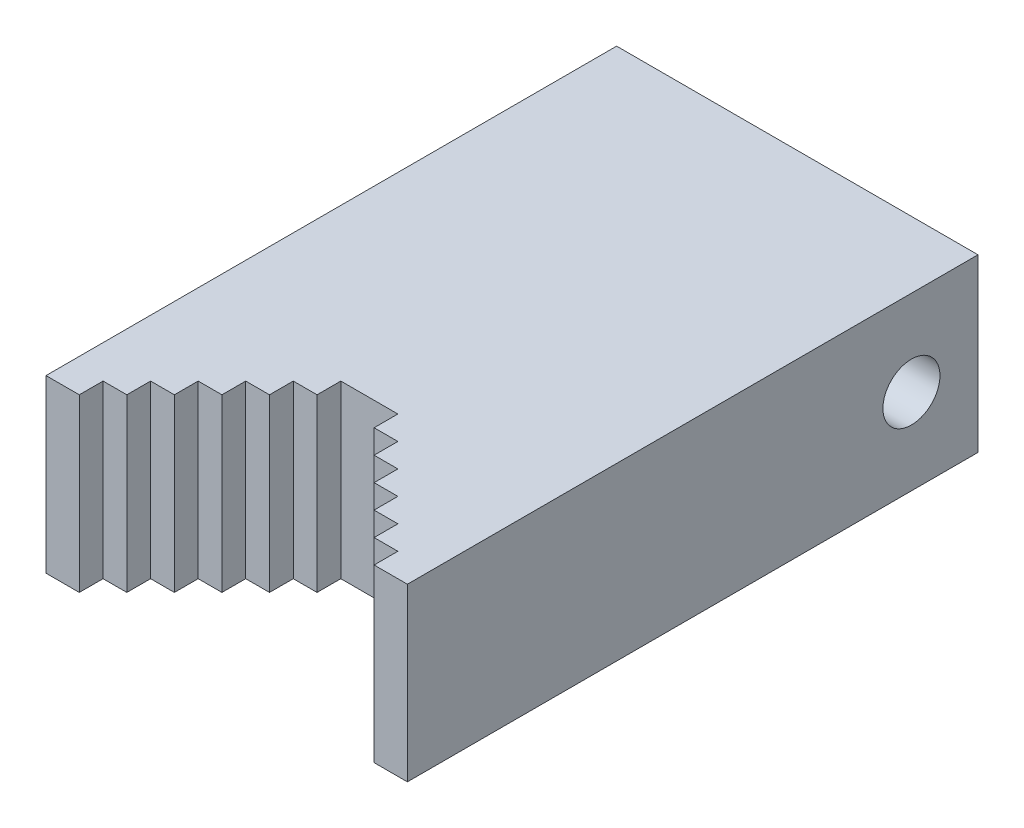
from build123d import *

# Parameters (mm, degrees)
BOSS_EXTRUDE1_DEPTH        = 18
SKETCH2_R                  = 3
CUT_EXTRUDE1_DEPTH         = 38
F_12_0MM_DOWEL_HOLE1_D     = 12
F_12_0MM_DOWEL_HOLE1_DEPTH = 20
F_12_0MM_DOWEL_HOLE1_TIP   = 3.605163714


with BuildPart() as part:
    # Sketch1 → Boss-Extrude1 (new body)
    with BuildSketch(Plane(origin=(0, 0, 0), x_dir=(1, 0, 0), z_dir=(0, 1, 0))):
        Polygon((0, 60), (0, 0), (3.5, 0), (3.5, 2.5), (6, 2.5), (6, 5), (8.5, 5), (8.5, 7.5), (11, 7.5), (11, 10), (13.5, 10), (13.5, 12.5), (16, 12.5), (16, 15), (22, 15), (22, 12.5), (24.5, 12.5), (24.5, 10), (27, 10), (27, 7.5), (29.5, 7.5), (29.5, 5), (32, 5), (32, 2.5), (34.5, 2.5), (34.5, 0), (38, 0), (38, 60), align=None)
    extrude(amount=BOSS_EXTRUDE1_DEPTH)

    # Sketch2 → Cut-Extrude1 (cut)
    with BuildSketch(Plane(origin=(38, 0, 0), x_dir=(0, 0, -1), z_dir=(1, 0, 0))):
        with Locations((53, 9)):
            Circle(SKETCH2_R)
    extrude(amount=-CUT_EXTRUDE1_DEPTH, mode=Mode.SUBTRACT)

    # Ø12.0mm Dowel Hole1
    with Locations(Plane(origin=(19, 9, -60), x_dir=(-1, 0, 0), z_dir=(0, 0, -1))):
        with Locations((0, 0)):
            Hole(F_12_0MM_DOWEL_HOLE1_D / 2, depth=F_12_0MM_DOWEL_HOLE1_DEPTH)
            with Locations((0, 0, -(F_12_0MM_DOWEL_HOLE1_DEPTH + F_12_0MM_DOWEL_HOLE1_TIP / 2))):  # 118° drill point
                Cone(0, F_12_0MM_DOWEL_HOLE1_D / 2, F_12_0MM_DOWEL_HOLE1_TIP, mode=Mode.SUBTRACT)


solid = part.part
